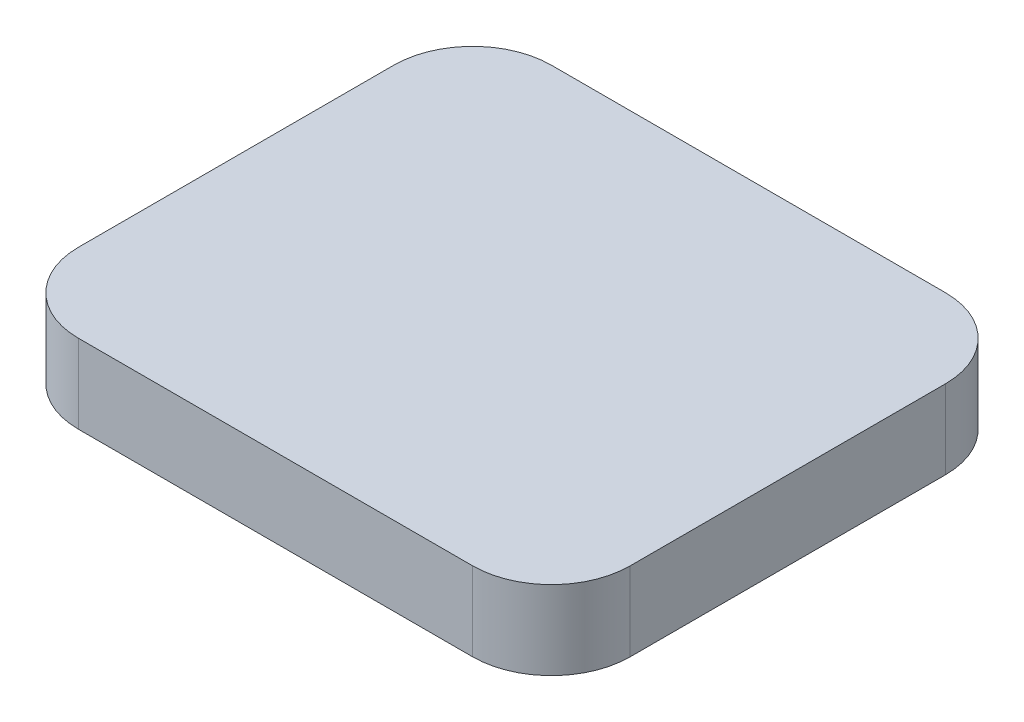
from build123d import *

# Parameters (mm, degrees)
RESSALTO_EXTRUS_O1_DEPTH = 1


with BuildPart() as part:
    # Esboço1 → Ressalto-extrusão1 (new body)
    with BuildSketch(Plane(origin=(0, 0, 0), x_dir=(1, 0, 0), z_dir=(0, 1, 0))):
        with BuildLine():
            Line((-2.5, -3), (2.5, -3))
            ThreePointArc((2.5, -3), (3.207106781, -2.707106781), (3.5, -2))
            Line((3.5, -2), (3.5, 2))
            ThreePointArc((3.5, 2), (3.207106781, 2.707106781), (2.5, 3))
            Line((2.5, 3), (-2.5, 3))
            ThreePointArc((-2.5, 3), (-3.207106781, 2.707106781), (-3.5, 2))
            Line((-3.5, 2), (-3.5, -2))
            ThreePointArc((-3.5, -2), (-3.207106781, -2.707106781), (-2.5, -3))
        make_face()
    extrude(amount=RESSALTO_EXTRUS_O1_DEPTH)


solid = part.part
